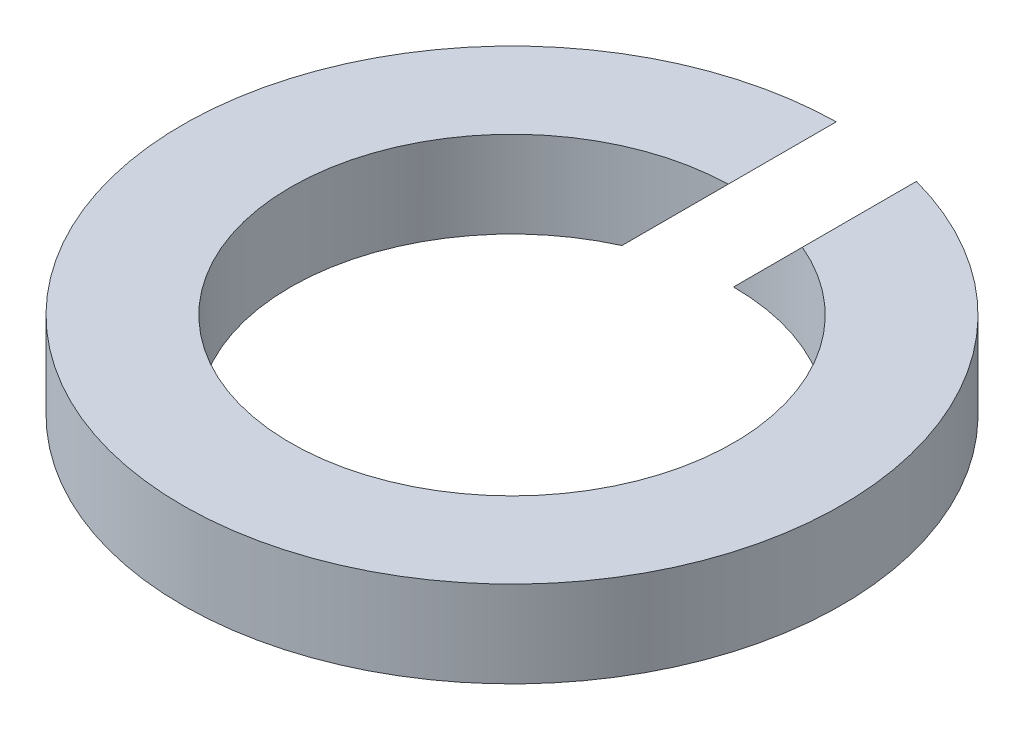
from build123d import *

# Parameters (mm, degrees)
SKETCH_1_R          = 6.1
SKETCH_1_R_2        = 4.1
EXTRUDE_1_DEPTH     = 1.6
CUT_EXTRUDE_1_DEPTH = 9.773824708


with BuildPart() as part:
    # Эскиз1 → Бобышка-Вытянуть1 (new body)
    with BuildSketch(Plane(origin=(0, 0, 0), x_dir=(1, 0, 0), z_dir=(0, 1, 0))):
        with Locations(Location((0, 0, 0), (0, 0, 270))):
            Circle(SKETCH_1_R)
        with Locations(Location((0, 0, 0), (0, 0, 270))):
            Circle(SKETCH_1_R_2, mode=Mode.SUBTRACT)
    extrude(amount=EXTRUDE_1_DEPTH)

    # Эскиз2 → Вырез-Вытянуть1 (cut, through all)
    with BuildSketch(Plane.XY):
        Polygon((0, 0), (1.6, 1.6), (-0.097056275, 1.6), (-1.697056275, 0), align=None)
    extrude(amount=-CUT_EXTRUDE_1_DEPTH, mode=Mode.SUBTRACT)


solid = part.part
